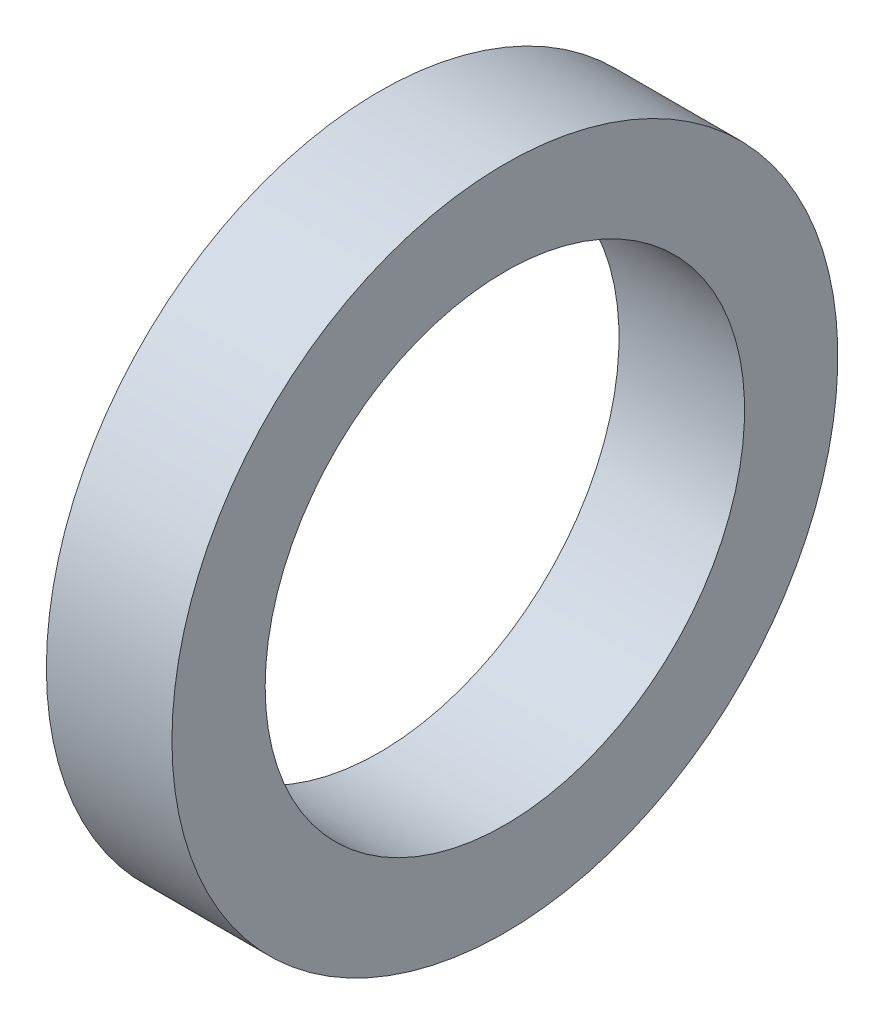
from build123d import *

# Parameters (mm, degrees)
SKETCH1_W = 4.714285714
SKETCH1_H = 3.5


with BuildPart() as part:
    # Sketch1 → Revolve1 (revolve)
    with BuildSketch(Plane(origin=(0, 0, 0), x_dir=(1, 0, 0), z_dir=(0, 1, 0)), mode=Mode.PRIVATE) as revolve1_sk:
        with Locations((2.357142857, 10.75)):
            Rectangle(SKETCH1_W, SKETCH1_H)
    revolve(revolve1_sk.sketch.rotate(Axis((0, 0, 0), (1, 0, 0)), 180), axis=Axis((0, 0, 0), (1, 0, 0)))


solid = part.part
